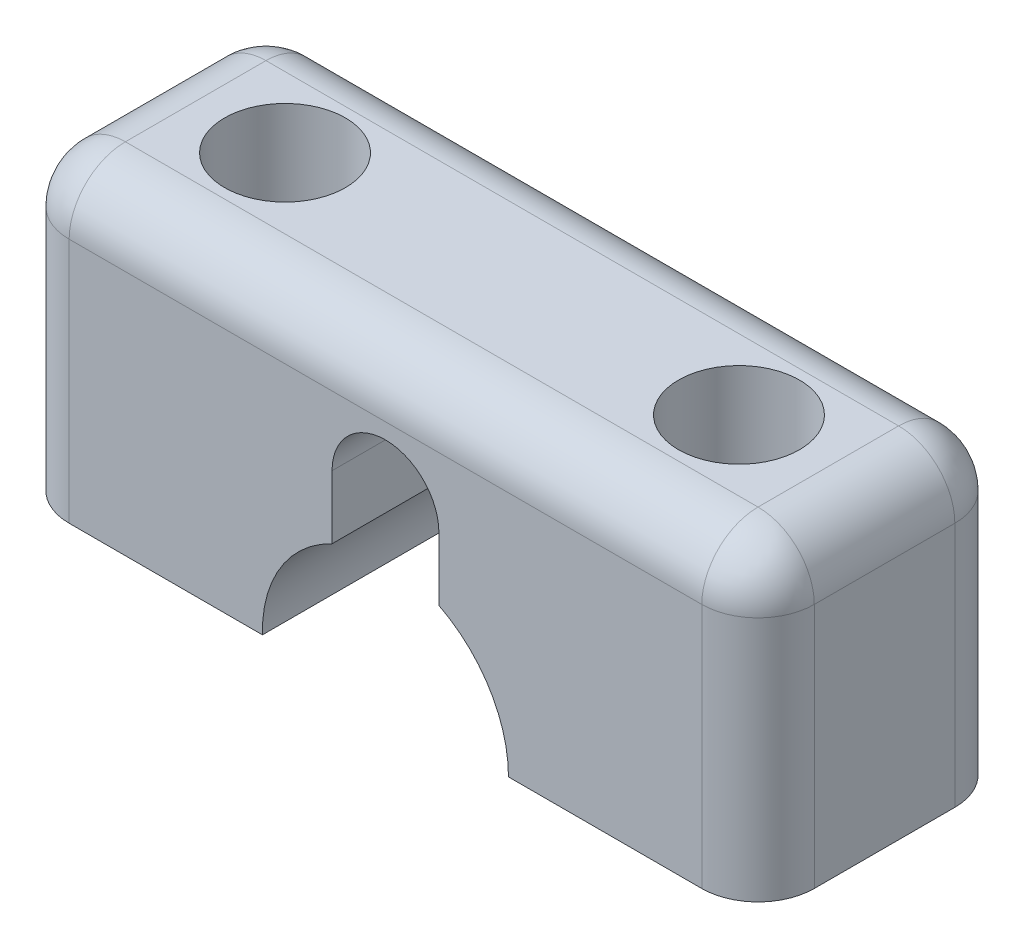
from build123d import *

# Parameters (mm, degrees)
BOSS_EXTRUDE2_DEPTH = 100
REVOLVE1_ANGLE      = 90
REVOLVE2_ANGLE      = 90
BOSS_EXTRUDE3_REACH = 1139.003
SKETCH10_W          = 80
SKETCH10_H          = 350
REVOLVE3_ANGLE      = 90
REVOLVE4_ANGLE      = 90
BOSS_EXTRUDE4_REACH = 1139.003
SKETCH14_R          = 86
SKETCH14_R_2        = 43
CUT_EXTRUDE2_DEPTH  = 135
SKETCH17_R          = 43
CUT_EXTRUDE3_DEPTH  = 583
CUT_EXTRUDE4_DEPTH  = 1340.48085047


with BuildPart() as part:
    # Sketch4 → Boss-Extrude2 (new, symmetric)
    with BuildSketch(Plane.XY):
        with BuildLine():
            Line((813.175605254, 117.699465094), (1168.175605254, 117.699465094))
            Line((1168.175605254, 117.699465094), (1168.175605254, 467.699465094))
            ThreePointArc((1168.175605254, 467.699465094), (1144.744147749, 524.268007589), (1088.175605254, 547.699465094))
            Line((1088.175605254, 547.699465094), (638.175605254, 547.699465094))
            Line((638.175605254, 547.699465094), (638.175605254, 445.457996532))
            ThreePointArc((638.175605254, 445.457996532), (691.915720625, 423.198111902), (714.175605254, 369.457996532))
            Line((714.175605254, 369.457996532), (714.175605254, 279.457996532))
            ThreePointArc((714.175605254, 279.457996532), (787.650444518, 213.251892507), (813.175605254, 117.699465094))
        make_face()
        with BuildLine():
            Line((638.175605254, 445.457996532), (638.175605254, 547.699465094))
            Line((638.175605254, 547.699465094), (188.175605254, 547.699465094))
            ThreePointArc((188.175605254, 547.699465094), (131.607062759, 524.268007589), (108.175605254, 467.699465094))
            Line((108.175605254, 467.699465094), (108.175605254, 117.699465094))
            Line((108.175605254, 117.699465094), (463.175605254, 117.699465094))
            ThreePointArc((463.175605254, 117.699465094), (488.70076599, 213.251892507), (562.175605254, 279.457996532))
            Line((562.175605254, 279.457996532), (562.175605254, 369.457996532))
            ThreePointArc((562.175605254, 369.457996532), (584.435489884, 423.198111902), (638.175605254, 445.457996532))
        make_face()
    extrude(amount=BOSS_EXTRUDE2_DEPTH, both=True)

    # Sketch7 → Revolve1 (revolve)
    with BuildSketch(Plane(origin=(0, 0, -100), x_dir=(-1, 0, 0), z_dir=(0, 0, -1))):
        with BuildLine():
            Line((-1088.175605254, 547.699465094), (-1088.175605254, 117.699465094))
            Line((-1088.175605254, 117.699465094), (-1168.175605254, 117.699465094))
            Line((-1168.175605254, 117.699465094), (-1168.175605254, 467.699465094))
            ThreePointArc((-1168.175605254, 467.699465094), (-1144.744147749, 524.268007589), (-1088.175605254, 547.699465094))
        make_face()
    revolve(axis=Axis((1088.175605254, 547.699465094, -100), (0, 1, 0)), revolution_arc=REVOLVE1_ANGLE)

    # Sketch8 → Revolve2 (revolve)
    with BuildSketch(Plane(origin=(0, 0, -100), x_dir=(-1, 0, 0), z_dir=(0, 0, -1))):
        with BuildLine():
            Line((-188.175605254, 547.699465094), (-188.175605254, 117.699465094))
            Line((-188.175605254, 117.699465094), (-108.175605254, 117.699465094))
            Line((-108.175605254, 117.699465094), (-108.175605254, 467.699465094))
            ThreePointArc((-108.175605254, 467.699465094), (-131.607062759, 524.268007589), (-188.175605254, 547.699465094))
        make_face()
    revolve(axis=Axis((188.175605254, 547.699465094, -100), (0, -1, 0)), revolution_arc=REVOLVE2_ANGLE)

    # Boss-Extrude3: up to this face of the body (flat: up to its plane)
    boss_extrude3_end = Plane(part.part.faces().sort_by_distance((188.175605254, 324.501535412, -139.079671816))[0])
    # Sketch10 → Boss-Extrude3 (add, up to the picked face)
    with BuildSketch(Plane.ZY.offset(-1088.175605254), mode=Mode.PRIVATE) as boss_extrude3_sk1:
        with BuildLine():
            Line((-100, 467.699465094), (-100, 547.699465094))
            ThreePointArc((-100, 547.699465094), (-156.568542495, 524.268007589), (-180, 467.699465094))
            Line((-180, 467.699465094), (-100, 467.699465094))
        make_face()
    boss_extrude3_tool1 = split(extrude(boss_extrude3_sk1.sketch, amount=BOSS_EXTRUDE3_REACH, mode=Mode.PRIVATE), bisect_by=boss_extrude3_end, keep=Keep.BOTH, mode=Mode.PRIVATE)
    # Sketch10 → Boss-Extrude3 (add, up to the picked face)
    with BuildSketch(Plane.ZY.offset(-1088.175605254), mode=Mode.PRIVATE) as boss_extrude3_sk2:
        with Locations((-140, 292.699465094)):
            Rectangle(SKETCH10_W, SKETCH10_H)
    boss_extrude3_tool2 = split(extrude(boss_extrude3_sk2.sketch, amount=BOSS_EXTRUDE3_REACH, mode=Mode.PRIVATE), bisect_by=boss_extrude3_end, keep=Keep.BOTH, mode=Mode.PRIVATE)
    add(boss_extrude3_tool1.solids().sort_by(Axis((1088.175605, 501.65252, -133.953055), (-1, 0, 0)))[0])
    add(boss_extrude3_tool2.solids().sort_by(Axis((1088.175605, 292.699465, -140), (-1, 0, 0)))[0])

    # Sketch11 → Revolve3 (revolve)
    with BuildSketch(Plane.XY.offset(100)):
        with BuildLine():
            Line((1088.175605254, 547.699465094), (1088.175605254, 117.699465094))
            Line((1088.175605254, 117.699465094), (1168.175605254, 117.699465094))
            Line((1168.175605254, 117.699465094), (1168.175605254, 467.699465094))
            ThreePointArc((1168.175605254, 467.699465094), (1144.744147749, 524.268007589), (1088.175605254, 547.699465094))
        make_face()
    revolve(axis=Axis((1088.175605254, 547.699465094, 100), (0, -1, 0)), revolution_arc=REVOLVE3_ANGLE)

    # Sketch12 → Revolve4 (revolve)
    with BuildSketch(Plane.XY.offset(100)):
        with BuildLine():
            Line((188.175605254, 547.699465094), (188.175605254, 117.699465094))
            Line((188.175605254, 117.699465094), (108.175605254, 117.699465094))
            Line((108.175605254, 117.699465094), (108.175605254, 467.699465094))
            ThreePointArc((108.175605254, 467.699465094), (131.607062759, 524.268007589), (188.175605254, 547.699465094))
        make_face()
    revolve(axis=Axis((188.175605254, 547.699465094, 100), (0, 1, 0)), revolution_arc=REVOLVE4_ANGLE)

    # Boss-Extrude4: up to this face of the body (flat: up to its plane)
    boss_extrude4_end = Plane(part.part.faces().sort_by_distance((1088.175605254, 324.501535412, 139.079671816))[0])
    # Sketch13 → Boss-Extrude4 (add, up to the picked face)
    with BuildSketch(Plane(origin=(188.175605254, 0, 0), x_dir=(0, 0, -1), z_dir=(1, 0, 0)), mode=Mode.PRIVATE) as boss_extrude4_sk1:
        with BuildLine():
            Line((-100, 547.699465094), (-100, 117.699465094))
            Line((-100, 117.699465094), (-180, 117.699465094))
            Line((-180, 117.699465094), (-180, 467.699465094))
            ThreePointArc((-180, 467.699465094), (-156.568542495, 524.268007589), (-100, 547.699465094))
        make_face()
    boss_extrude4_tool1 = split(extrude(boss_extrude4_sk1.sketch, amount=BOSS_EXTRUDE4_REACH, mode=Mode.PRIVATE), bisect_by=boss_extrude4_end, keep=Keep.BOTH, mode=Mode.PRIVATE)
    add(boss_extrude4_tool1.solids().sort_by(Axis((188.175605, 324.501535, 139.079672), (1, 0, 0)))[0])

    # Sketch14 → Cut-Extrude2 (cut)
    # profile 1 of 2: a face of its own
    with BuildSketch(Plane(origin=(0, 547.699465094, 0), x_dir=(1, 0, 0), z_dir=(0, 1, 0))):
        with Locations(Location((961.100411774, 0, 0), (0, 0, 270))):
            Circle(SKETCH14_R)
        with Locations(Location((961.100411774, 0, 0), (0, 0, 270))):
            Circle(SKETCH14_R_2, mode=Mode.SUBTRACT)
    # profile 2 of 2: a face of its own
    with BuildSketch(Plane(origin=(0, 547.699465094, 0), x_dir=(1, 0, 0), z_dir=(0, 1, 0))):
        with Locations(Location((315.250798734, 0, 0), (0, 0, 90))):
            Circle(SKETCH14_R)
        with Locations(Location((315.250798734, 0, 0), (0, 0, 90))):
            Circle(SKETCH14_R_2, mode=Mode.SUBTRACT)
    extrude(amount=-CUT_EXTRUDE2_DEPTH, mode=Mode.SUBTRACT)

    # Sketch17 → Cut-Extrude3 (cut)
    with BuildSketch(Plane(origin=(0, 547.699465094, 0), x_dir=(1, 0, 0), z_dir=(0, 1, 0))):
        with Locations(Location((961.100411774, 0, 0), (0, 0, 270))):
            Circle(SKETCH17_R)
        with Locations(Location((315.250798734, 0, 0), (0, 0, 270))):
            Circle(SKETCH17_R)
    extrude(amount=-CUT_EXTRUDE3_DEPTH, mode=Mode.SUBTRACT)

    # Sketch18 → Cut-Extrude4 (cut, through all)
    with BuildSketch(Plane(origin=(0, 0, -180), x_dir=(-1, 0, 0), z_dir=(0, 0, -1))):
        with BuildLine():
            Line((-714.175605254, 279.457996532), (-714.175605254, 369.457996532))
            ThreePointArc((-714.175605254, 369.457996532), (-638.175605254, 445.457996532), (-562.175605254, 369.457996532))
            Line((-562.175605254, 369.457996532), (-562.175605254, 279.457996532))
            ThreePointArc((-562.175605254, 279.457996532), (-488.70076599, 213.251892507), (-463.175605254, 117.699465094))
            Line((-463.175605254, 117.699465094), (-813.175605254, 117.699465094))
            ThreePointArc((-813.175605254, 117.699465094), (-786.461236826, 212.524069618), (-714.175605254, 279.457996532))
        make_face()
    extrude(amount=-CUT_EXTRUDE4_DEPTH, mode=Mode.SUBTRACT)


solid = part.part
